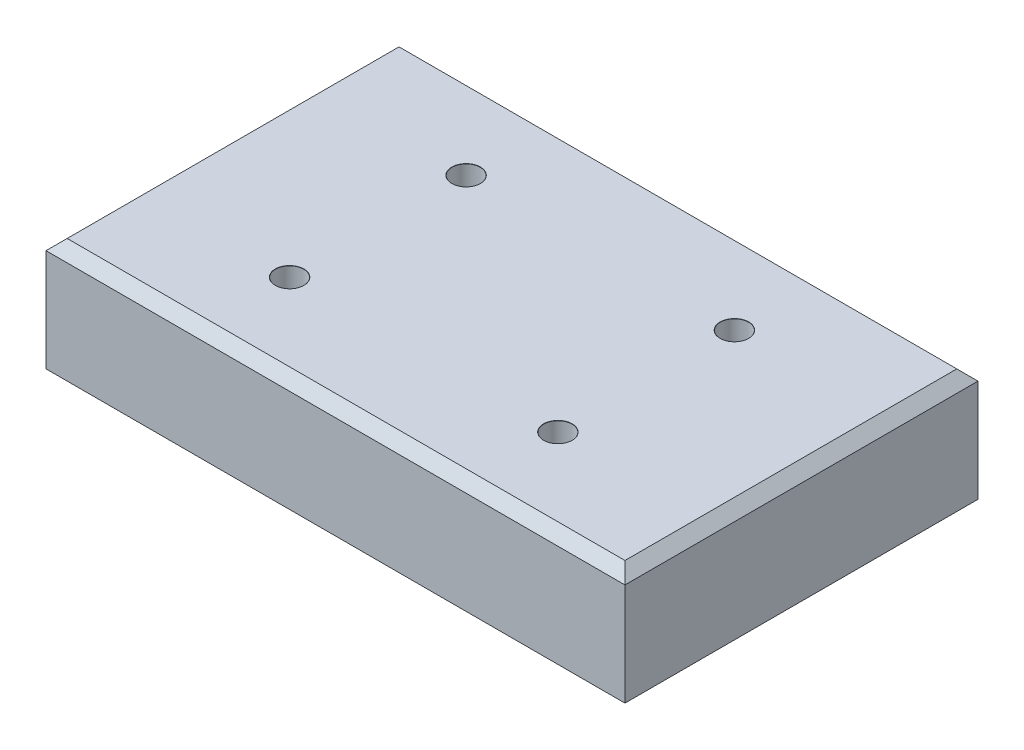
from build123d import *

# Parameters (mm, degrees)
SKETCH1_W                       = 82
SKETCH1_H                       = 50
SKETCH1_R                       = 2
BOSS_EXTRUDE1_DEPTH             = 16
SKETCH2_R                       = 2
CUT_EXTRUDE1_DEPTH              = 6
M4X0_7_TAPPED_HOLE1_D           = 3.3
M4X0_7_TAPPED_HOLE1_DEPTH       = 7.008579979
M4X0_7_TAPPED_HOLE1_CSINK_D     = 4.05
M4X0_7_TAPPED_HOLE1_CSINK_ANGLE = 90
M4X0_7_TAPPED_HOLE1_TIP         = 0.991420021
CHAMFER1_SIZE                   = 1.5


with BuildPart() as part:
    # Sketch1 → Boss-Extrude1 (new body)
    # profile 1 of 5: a face of its own
    with BuildSketch(Plane(origin=(0, 0, 0), x_dir=(1, 0, 0), z_dir=(0, 1, 0))):
        Rectangle(SKETCH1_W, SKETCH1_H)
        with Locations((19, -12.5)):
            Circle(SKETCH1_R, mode=Mode.SUBTRACT)
        with Locations((-19, -12.5)):
            Circle(SKETCH1_R, mode=Mode.SUBTRACT)
        with Locations((-19, 12.5)):
            Circle(SKETCH1_R, mode=Mode.SUBTRACT)
        with Locations((19, 12.5)):
            Circle(SKETCH1_R, mode=Mode.SUBTRACT)
    # profile 2 of 5: a face of its own
    with BuildSketch(Plane(origin=(0, 0, 0), x_dir=(1, 0, 0), z_dir=(0, 1, 0))):
        with Locations((-19, 12.5)):
            Circle(SKETCH1_R)
    # profile 3 of 5: a face of its own
    with BuildSketch(Plane(origin=(0, 0, 0), x_dir=(1, 0, 0), z_dir=(0, 1, 0))):
        with Locations((19, -12.5)):
            Circle(SKETCH1_R)
    # profile 4 of 5: a face of its own
    with BuildSketch(Plane(origin=(0, 0, 0), x_dir=(1, 0, 0), z_dir=(0, 1, 0))):
        with Locations((19, 12.5)):
            Circle(SKETCH1_R)
    # profile 5 of 5: a face of its own
    with BuildSketch(Plane(origin=(0, 0, 0), x_dir=(1, 0, 0), z_dir=(0, 1, 0))):
        with Locations((-19, -12.5)):
            Circle(SKETCH1_R)
    extrude(amount=BOSS_EXTRUDE1_DEPTH)

    # Sketch2 → Cut-Extrude1 (cut)
    with BuildSketch(Plane(origin=(0, 16, 0), x_dir=(1, 0, 0), z_dir=(0, 1, 0))):
        with Locations(Location((-19, -12.5, 0), (0, 0, 270))):
            Circle(SKETCH2_R)
        with Locations(Location((-19, 12.5, 0), (0, 0, 270))):
            Circle(SKETCH2_R)
        with Locations(Location((19, -12.5, 0), (0, 0, 270))):
            Circle(SKETCH2_R)
        with Locations(Location((19, 12.5, 0), (0, 0, 270))):
            Circle(SKETCH2_R)
    extrude(amount=-CUT_EXTRUDE1_DEPTH, mode=Mode.SUBTRACT)

    # M4x0.7 Tapped Hole1
    with Locations(Plane(origin=(-19, 16, -12.5), x_dir=(0, 0, 1), z_dir=(0, 1, 0))):
        with Locations((0, 0), (0, 38), (25, 38), (25, 0)):
            CounterSinkHole(M4X0_7_TAPPED_HOLE1_D / 2, M4X0_7_TAPPED_HOLE1_CSINK_D / 2, depth=M4X0_7_TAPPED_HOLE1_DEPTH, counter_sink_angle=M4X0_7_TAPPED_HOLE1_CSINK_ANGLE)
            with Locations((0, 0, -(M4X0_7_TAPPED_HOLE1_DEPTH + M4X0_7_TAPPED_HOLE1_TIP / 2))):  # 118° drill point
                Cone(0, M4X0_7_TAPPED_HOLE1_D / 2, M4X0_7_TAPPED_HOLE1_TIP, mode=Mode.SUBTRACT)

    # Chamfer1
    chamfer1_edges = [part.edges().sort_by_distance(p)[0] for p in [
        (0, 16, 25),
        (41, 16, 0),
        (0, 16, -25),
        (-41, 16, 0),
    ]]
    chamfer(chamfer1_edges, length=CHAMFER1_SIZE)


solid = part.part
